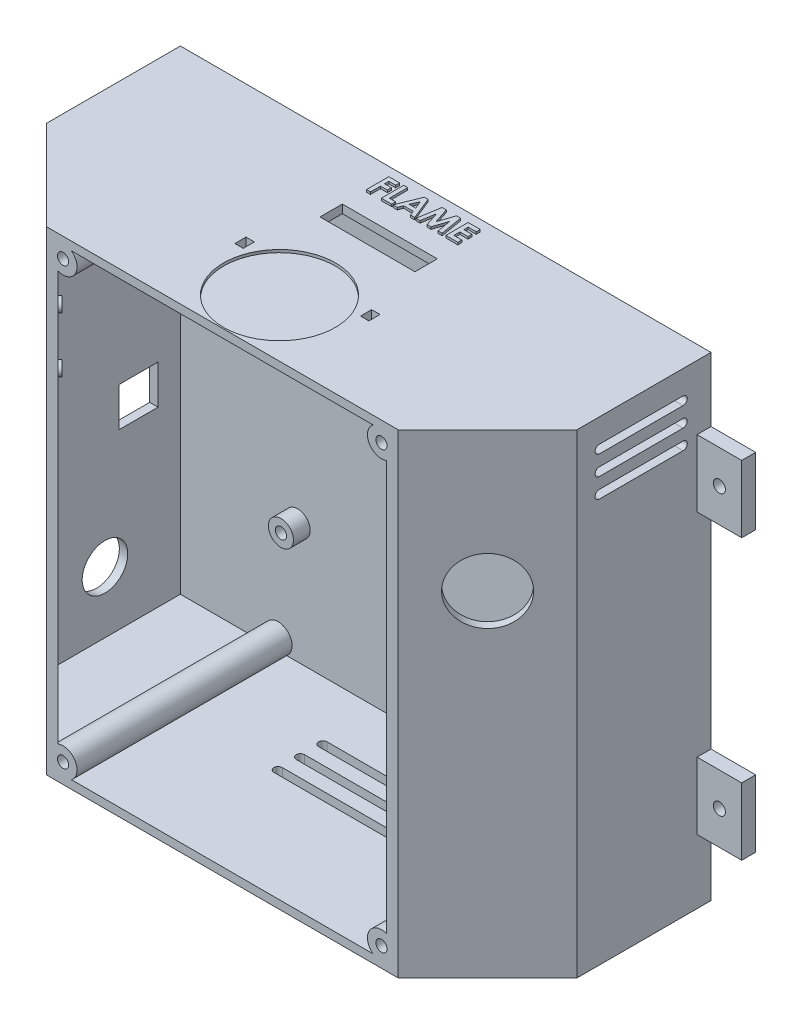
from build123d import *

# Parameters (mm, degrees)
BLOCK_DEPTH                 = 170
SHELL1_T                    = -3
SKETCH2_R                   = 5
PANEL_COLUMNS_DEPTH         = 80
SKETCH3_R                   = 2
PANEL_INSERT_HOLES_DEPTH    = 7
SKETCH4_R                   = 4.5
PLATE_BOSSES_DEPTH          = 6
SKETCH5_R                   = 2
PLATE_INSERT_HOLES_DEPTH    = 7
SKETCH6_W                   = 14
SKETCH6_H                   = 14
USB_ACCESS_DEPTH            = 4
SKETCH7_R                   = 8.15
DC_IN_DEPTH                 = 4
INTAKE_SLOTS_DEPTH          = 4
OUTLET_SLOTS_LEFT_DEPTH     = 4
OUTLET_START                = -4
OUTLET_SLOTS_RIGHT_DEPTH    = 4
SKETCH11_R                  = 20.025
FLAME_POCKET_DEPTH          = 1
SKETCH12_W                  = 3
SKETCH12_H                  = 4
SKETCH12_W_2                = 34
SKETCH12_H_2                = 8
FLAME_TIE_WIRE_SLOTS_DEPTH  = 4
FLAME_LABEL_RAISED_DEPTH    = 0.8
SKETCH14_R                  = 5
FEET_DEPTH                  = 3
SKETCH15_W                  = 16
SKETCH15_H                  = 24
WALL_EARS_DEPTH             = 5
SKETCH16_R                  = 2.15
WALL_EAR_SCREW_HOLES_DEPTH  = 219.846156009
SKETCH17_R                  = 11.65
PIR_1_LEFT_DOME_HOLE_DEPTH  = 4
SKETCH18_R                  = 2.2
PIR_1_LEFT_BOSSES_DEPTH     = 1
SKETCH19_R                  = 0.8
PIR_1_LEFT_M2_PILOTS_DEPTH  = 3
SKETCH20_R                  = 11.65
PIR_2_RIGHT_DOME_HOLE_DEPTH = 4
SKETCH21_R                  = 2.2
PIR_2_RIGHT_BOSSES_DEPTH    = 1
SKETCH22_R                  = 0.8
PIR_2_RIGHT_M2_PILOTS_DEPTH = 3


with BuildPart() as part:
    # Sketch1 → Block (new body)
    with BuildSketch(Plane(origin=(0, 0, 0), x_dir=(1, 0, 0), z_dir=(0, 1, 0))):
        Polygon((-95, 0), (95, 0), (95, -48), (63, -80), (-63, -80), (-95, -48), align=None)
    extrude(amount=BLOCK_DEPTH)

    # Shell1
    shell1_openings = [part.faces().sort_by_distance(p)[0] for p in [
        (0, 85, 80),
    ]]
    offset(amount=SHELL1_T, openings=shell1_openings, kind=Kind.INTERSECTION)

    # Sketch2 → Panel columns (add)
    with BuildSketch(Plane.XY):
        with Locations((-57, 7)):
            Circle(SKETCH2_R)
        with Locations((57, 7)):
            Circle(SKETCH2_R)
        with Locations((-57, 163)):
            Circle(SKETCH2_R)
        with Locations((57, 163)):
            Circle(SKETCH2_R)
    extrude(amount=PANEL_COLUMNS_DEPTH)

    # Sketch3 → Panel insert holes (cut)
    with BuildSketch(Plane.XY.offset(80)):
        with Locations((-57, 7)):
            Circle(SKETCH3_R)
        with Locations((57, 7)):
            Circle(SKETCH3_R)
        with Locations((-57, 163)):
            Circle(SKETCH3_R)
        with Locations((57, 163)):
            Circle(SKETCH3_R)
    extrude(amount=-PANEL_INSERT_HOLES_DEPTH, mode=Mode.SUBTRACT)

    # Sketch4 → Plate bosses (add)
    with BuildSketch(Plane.XY.offset(3)):
        with Locations((-50, 46)):
            Circle(SKETCH4_R)
        with Locations((50, 46)):
            Circle(SKETCH4_R)
        with Locations((-50, 150)):
            Circle(SKETCH4_R)
        with Locations((50, 150)):
            Circle(SKETCH4_R)
    extrude(amount=PLATE_BOSSES_DEPTH)

    # Sketch5 → Plate insert holes (cut)
    with BuildSketch(Plane.XY.offset(9)):
        with Locations((-50, 46)):
            Circle(SKETCH5_R)
        with Locations((50, 46)):
            Circle(SKETCH5_R)
        with Locations((-50, 150)):
            Circle(SKETCH5_R)
        with Locations((50, 150)):
            Circle(SKETCH5_R)
    extrude(amount=-PLATE_INSERT_HOLES_DEPTH, mode=Mode.SUBTRACT)

    # Sketch6 → USB access (cut)
    with BuildSketch(Plane(origin=(-95, 0, 0), x_dir=(0, 0, -1), z_dir=(1, 0, 0))):
        with Locations((-18, 72)):
            Rectangle(SKETCH6_W, SKETCH6_H)
    extrude(amount=USB_ACCESS_DEPTH, mode=Mode.SUBTRACT)

    # Sketch7 → DC in (cut)
    with BuildSketch(Plane(origin=(-95, 0, 0), x_dir=(0, 0, -1), z_dir=(1, 0, 0))):
        with Locations((-30, 25)):
            Circle(SKETCH7_R)
    extrude(amount=DC_IN_DEPTH, mode=Mode.SUBTRACT)

    # Sketch8 → Intake slots (cut)
    with BuildSketch(Plane(origin=(0, 0, 0), x_dir=(1, 0, 0), z_dir=(0, 1, 0))):
        with BuildLine():
            Line((-20, -22.5), (20, -22.5))
            ThreePointArc((20, -22.5), (21.5, -24), (20, -25.5))
            Line((20, -25.5), (-20, -25.5))
            ThreePointArc((-20, -25.5), (-21.5, -24), (-20, -22.5))
        make_face()
        with BuildLine():
            Line((-20, -30.5), (20, -30.5))
            ThreePointArc((20, -30.5), (21.5, -32), (20, -33.5))
            Line((20, -33.5), (-20, -33.5))
            ThreePointArc((-20, -33.5), (-21.5, -32), (-20, -30.5))
        make_face()
        with BuildLine():
            Line((-20, -38.5), (20, -38.5))
            ThreePointArc((20, -38.5), (21.5, -40), (20, -41.5))
            Line((20, -41.5), (-20, -41.5))
            ThreePointArc((-20, -41.5), (-21.5, -40), (-20, -38.5))
        make_face()
    extrude(amount=INTAKE_SLOTS_DEPTH, mode=Mode.SUBTRACT)

    # Sketch9 → Outlet slots left (cut)
    with BuildSketch(Plane(origin=(-95, 0, 0), x_dir=(0, 0, -1), z_dir=(1, 0, 0))):
        with BuildLine():
            Line((-10, 144.5), (-40, 144.5))
            ThreePointArc((-40, 144.5), (-41.5, 146), (-40, 147.5))
            Line((-40, 147.5), (-10, 147.5))
            ThreePointArc((-10, 147.5), (-8.5, 146), (-10, 144.5))
        make_face()
        with BuildLine():
            Line((-10, 151.5), (-40, 151.5))
            ThreePointArc((-40, 151.5), (-41.5, 153), (-40, 154.5))
            Line((-40, 154.5), (-10, 154.5))
            ThreePointArc((-10, 154.5), (-8.5, 153), (-10, 151.5))
        make_face()
        with BuildLine():
            Line((-10, 158.5), (-40, 158.5))
            ThreePointArc((-40, 158.5), (-41.5, 160), (-40, 161.5))
            Line((-40, 161.5), (-10, 161.5))
            ThreePointArc((-10, 161.5), (-8.5, 160), (-10, 158.5))
        make_face()
    extrude(amount=OUTLET_SLOTS_LEFT_DEPTH, mode=Mode.SUBTRACT)

    # Sketch10 → Outlet slots right (cut)
    with BuildSketch(Plane(origin=(95, 0, 0), x_dir=(0, 0, -1), z_dir=(1, 0, 0)).offset(OUTLET_START)):
        with BuildLine():
            Line((-10, 144.5), (-40, 144.5))
            ThreePointArc((-40, 144.5), (-41.5, 146), (-40, 147.5))
            Line((-40, 147.5), (-10, 147.5))
            ThreePointArc((-10, 147.5), (-8.5, 146), (-10, 144.5))
        make_face()
        with BuildLine():
            Line((-10, 151.5), (-40, 151.5))
            ThreePointArc((-40, 151.5), (-41.5, 153), (-40, 154.5))
            Line((-40, 154.5), (-10, 154.5))
            ThreePointArc((-10, 154.5), (-8.5, 153), (-10, 151.5))
        make_face()
        with BuildLine():
            Line((-10, 158.5), (-40, 158.5))
            ThreePointArc((-40, 158.5), (-41.5, 160), (-40, 161.5))
            Line((-40, 161.5), (-10, 161.5))
            ThreePointArc((-10, 161.5), (-8.5, 160), (-10, 158.5))
        make_face()
    extrude(amount=OUTLET_SLOTS_RIGHT_DEPTH, mode=Mode.SUBTRACT)

    # Sketch11 → Flame pocket (cut)
    with BuildSketch(Plane(origin=(0, 170, 0), x_dir=(1, 0, 0), z_dir=(0, 1, 0))):
        with Locations(Location((0, -59.5, 0), (0, 0, 270))):
            Circle(SKETCH11_R)
    extrude(amount=-FLAME_POCKET_DEPTH, mode=Mode.SUBTRACT)

    # Sketch12 → Flame tie + wire slots (cut)
    with BuildSketch(Plane(origin=(0, 170, 0), x_dir=(1, 0, 0), z_dir=(0, 1, 0))):
        with Locations((-22.5, -49.5)):
            Rectangle(SKETCH12_W, SKETCH12_H)
        with Locations((22.5, -49.5)):
            Rectangle(SKETCH12_W, SKETCH12_H)
        with Locations((0, -24)):
            Rectangle(SKETCH12_W_2, SKETCH12_H_2)
    extrude(amount=-FLAME_TIE_WIRE_SLOTS_DEPTH, mode=Mode.SUBTRACT)

    # Sketch13 → FLAME label (raised) (add)
    # profile 1 of 5: a face of its own
    with BuildSketch(Plane(origin=(0, 170, 0), x_dir=(1, 0, 0), z_dir=(0, 1, 0))):
        Polygon((-16.358974359, -4), (-12.461538462, -4), (-12.461538462, -5.435897436), (-14.923076923, -5.435897436), (-14.923076923, -6.974358974), (-12.461538462, -6.974358974), (-12.461538462, -8.41025641), (-14.923076923, -8.41025641), (-14.923076923, -12), (-16.358974359, -12), align=None)
    # profile 2 of 5: a face of its own
    with BuildSketch(Plane(origin=(0, 170, 0), x_dir=(1, 0, 0), z_dir=(0, 1, 0))):
        Polygon((-11.025641026, -4), (-9.58974359, -4), (-9.58974359, -10.564102564), (-7.333333333, -10.564102564), (-7.333333333, -12), (-11.025641026, -12), align=None)
    # profile 3 of 5: a face of its own
    with BuildSketch(Plane(origin=(0, 170, 0), x_dir=(1, 0, 0), z_dir=(0, 1, 0))):
        Polygon((-3.642628205, -4), (-2.307692308, -4), (0.923076923, -12), (-0.610576923, -12), (-1.232371795, -10.358974359), (-4.71474359, -10.358974359), (-5.338141026, -12), (-6.871794872, -12), align=None)
        Polygon((-2.974358974, -6.145833333), (-4.169871795, -8.923076923), (-1.77724359, -8.923076923), align=None, mode=Mode.SUBTRACT)
    # profile 4 of 5: a face of its own
    with BuildSketch(Plane(origin=(0, 170, 0), x_dir=(1, 0, 0), z_dir=(0, 1, 0))):
        Polygon((2.735576923, -4), (4.22275641, -4), (6.051282051, -9.580128205), (7.889423077, -4), (9.365384615, -4), (10.717948718, -12), (9.264423077, -12), (8.41025641, -6.947115385), (6.746794872, -12), (5.34775641, -12), (3.692307692, -6.947115385), (2.83974359, -12), (1.384615385, -12), align=None)
    # profile 5 of 5: a face of its own
    with BuildSketch(Plane(origin=(0, 170, 0), x_dir=(1, 0, 0), z_dir=(0, 1, 0))):
        Polygon((12.051282051, -4), (16.358974359, -4), (16.358974359, -5.435897436), (13.487179487, -5.435897436), (13.487179487, -6.974358974), (16.358974359, -6.974358974), (16.358974359, -8.41025641), (13.487179487, -8.41025641), (13.487179487, -10.564102564), (16.358974359, -10.564102564), (16.358974359, -12), (12.051282051, -12), align=None)
    extrude(amount=FLAME_LABEL_RAISED_DEPTH)

    # Sketch14 → Feet (add)
    with BuildSketch(Plane(origin=(0, 0, 0), x_dir=(1, 0, 0), z_dir=(0, 1, 0))):
        with Locations(Location((-80, -10, 0), (0, 0, 270))):
            Circle(SKETCH14_R)
        with Locations(Location((-80, -40, 0), (0, 0, 270))):
            Circle(SKETCH14_R)
        with Locations(Location((80, -10, 0), (0, 0, 270))):
            Circle(SKETCH14_R)
        with Locations(Location((80, -40, 0), (0, 0, 270))):
            Circle(SKETCH14_R)
    extrude(amount=-FEET_DEPTH)

    # Sketch15 → Wall ears (add)
    with BuildSketch(Plane.XY):
        with Locations((-103, 35)):
            Rectangle(SKETCH15_W, SKETCH15_H)
        with Locations((103, 35)):
            Rectangle(SKETCH15_W, SKETCH15_H)
        with Locations((-103, 135)):
            Rectangle(SKETCH15_W, SKETCH15_H)
        with Locations((103, 135)):
            Rectangle(SKETCH15_W, SKETCH15_H)
    extrude(amount=WALL_EARS_DEPTH)

    # Sketch16 → Wall ear screw holes (cut, through all)
    with BuildSketch(Plane.XY):
        with Locations(Location((-103, 35, 0), (0, 0, 180))):
            Circle(SKETCH16_R)
        with Locations(Location((103, 35, 0), (0, 0, 180))):
            Circle(SKETCH16_R)
        with Locations(Location((-103, 135, 0), (0, 0, 180))):
            Circle(SKETCH16_R)
        with Locations(Location((103, 135, 0), (0, 0, 180))):
            Circle(SKETCH16_R)
    extrude(amount=WALL_EAR_SCREW_HOLES_DEPTH, mode=Mode.SUBTRACT)

    # Sketch17 → PIR 1 (left) dome hole (cut)
    with BuildSketch(Plane(origin=(-71.5, 0, 71.5), x_dir=(0.7071067811865475, 0, 0.7071067811865477), z_dir=(-0.7071067811865477, 0, 0.7071067811865475))):
        with Locations((-10.606601718, 120)):
            Circle(SKETCH17_R)
    extrude(amount=-PIR_1_LEFT_DOME_HOLE_DEPTH, mode=Mode.SUBTRACT)

    # Sketch18 → PIR 1 (left) bosses (add)
    with BuildSketch(Plane(origin=(-69.378679656, 0, 69.378679656), x_dir=(-0.7071067811865475, 0, -0.7071067811865477), z_dir=(0.7071067811865477, 0, -0.7071067811865475))):
        with Locations((24.606601718, 120)):
            Circle(SKETCH18_R)
        with Locations((-3.393398282, 120)):
            Circle(SKETCH18_R)
    extrude(amount=PIR_1_LEFT_BOSSES_DEPTH)

    # Sketch19 → PIR 1 (left) M2 pilots (cut)
    with BuildSketch(Plane(origin=(-68.671572875, 0, 68.671572875), x_dir=(-0.7071067811865476, 0, -0.7071067811865476), z_dir=(0.7071067811865476, 0, -0.7071067811865476))):
        with Locations((24.606601718, 120)):
            Circle(SKETCH19_R)
        with Locations((-3.393398282, 120)):
            Circle(SKETCH19_R)
    extrude(amount=-PIR_1_LEFT_M2_PILOTS_DEPTH, mode=Mode.SUBTRACT)

    # Sketch20 → PIR 2 (right) dome hole (cut)
    with BuildSketch(Plane(origin=(71.5, 0, 71.5), x_dir=(0.7071067811865475, 0, -0.7071067811865477), z_dir=(0.7071067811865477, 0, 0.7071067811865475))):
        with Locations((10.606601718, 120)):
            Circle(SKETCH20_R)
    extrude(amount=-PIR_2_RIGHT_DOME_HOLE_DEPTH, mode=Mode.SUBTRACT)

    # Sketch21 → PIR 2 (right) bosses (add)
    with BuildSketch(Plane(origin=(69.378679656, 0, 69.378679656), x_dir=(-0.7071067811865475, 0, 0.7071067811865477), z_dir=(-0.7071067811865477, 0, -0.7071067811865475))):
        with Locations((-24.606601718, 120)):
            Circle(SKETCH21_R)
        with Locations((3.393398282, 120)):
            Circle(SKETCH21_R)
    extrude(amount=PIR_2_RIGHT_BOSSES_DEPTH)

    # Sketch22 → PIR 2 (right) M2 pilots (cut)
    with BuildSketch(Plane(origin=(68.671572875, 0, 68.671572875), x_dir=(-0.7071067811865476, 0, 0.7071067811865476), z_dir=(-0.7071067811865476, 0, -0.7071067811865476))):
        with Locations((-24.606601718, 120)):
            Circle(SKETCH22_R)
        with Locations((3.393398282, 120)):
            Circle(SKETCH22_R)
    extrude(amount=-PIR_2_RIGHT_M2_PILOTS_DEPTH, mode=Mode.SUBTRACT)


solid = part.part
